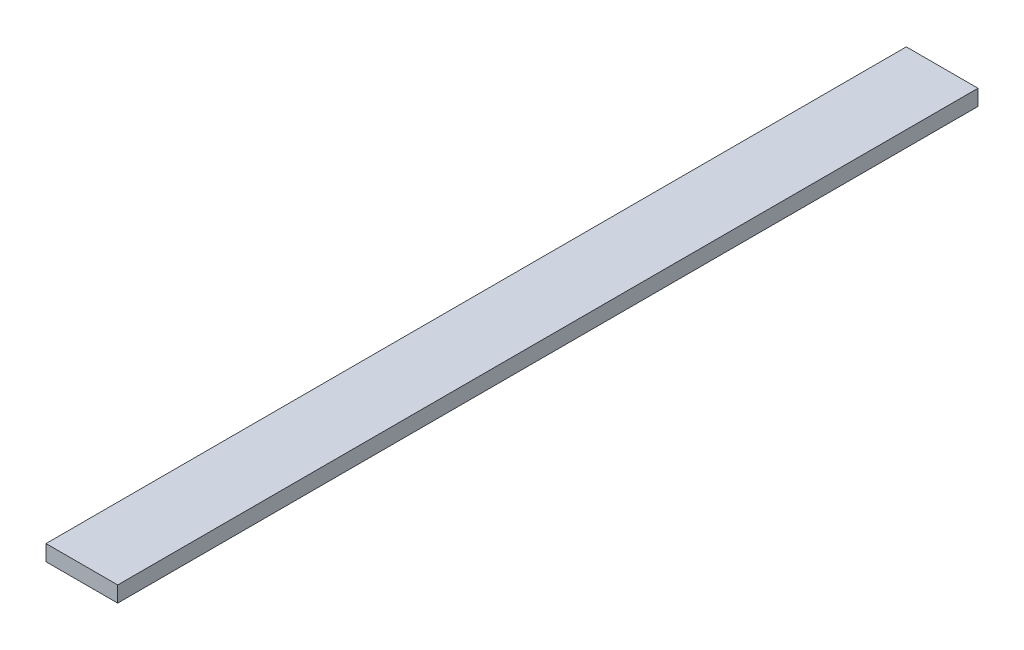
from build123d import *

# Parameters (mm, degrees)
IZIM1_W                     = 100
IZIM1_H                     = 1200
Y_KSEKLIK_EKSTR_ZYON1_DEPTH = 22


with BuildPart() as part:
    # Çizim1 → Yükseklik-Ekstrüzyon1 (new body)
    with BuildSketch(Plane(origin=(0, 0, 0), x_dir=(1, 0, 0), z_dir=(0, 1, 0))):
        Rectangle(IZIM1_W, IZIM1_H)
    extrude(amount=Y_KSEKLIK_EKSTR_ZYON1_DEPTH)


solid = part.part
